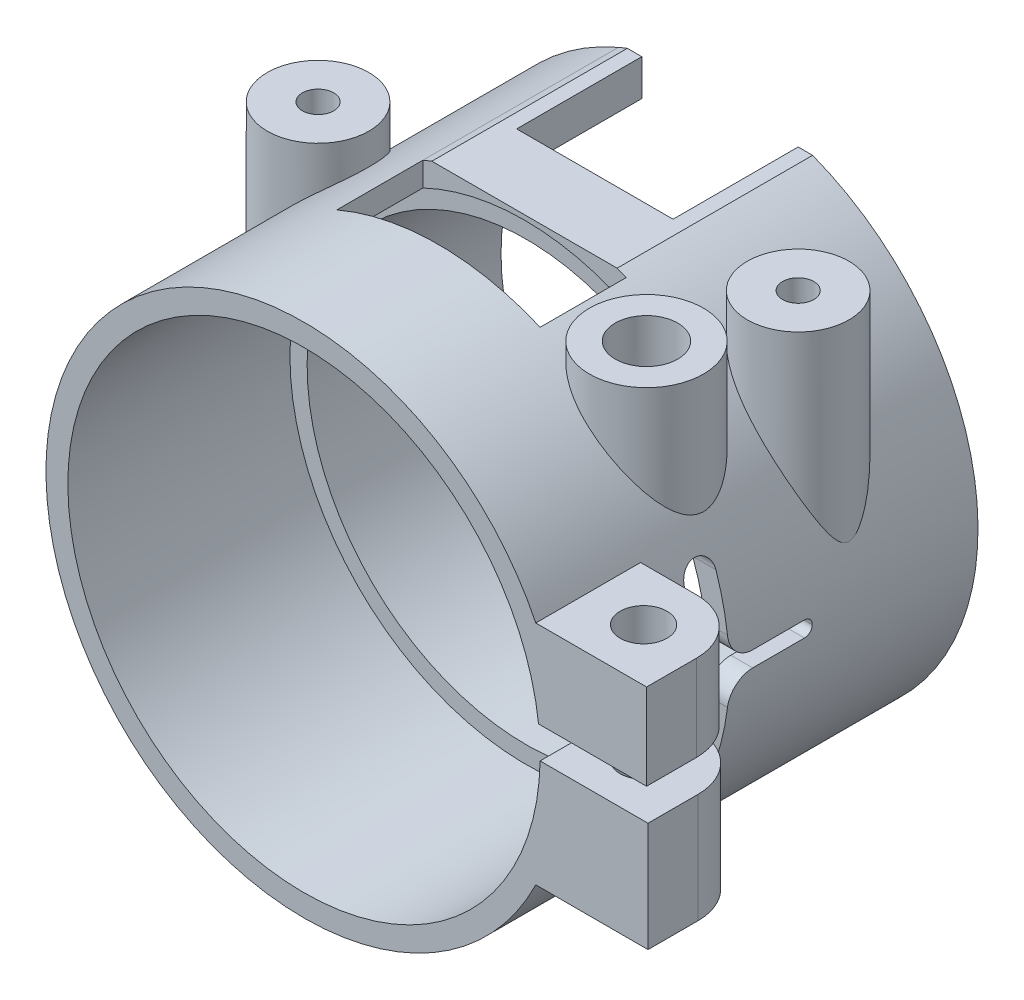
from build123d import *

# Parameters (mm, degrees)
CROQUIS1_R                   = 16.5
CROQUIS1_R_2                 = 14
SALIENTE_EXTRUIR1_DEPTH      = 12.4
CROQUIS2_R                   = 16.5
CROQUIS2_R_2                 = 15.1
SALIENTE_EXTRUIR2_DEPTH      = 14.2
CROQUIS6_W                   = 10
CROQUIS6_H                   = 3.423303169
CORTAR_EXTRUIR4_DEPTH        = 8
CROQUIS7_W                   = 12.5
CROQUIS7_H                   = 1.1
CORTAR_EXTRUIR5_DEPTH        = 18
CORTAR_EXTRUIR6_REACH        = 46.693
CORTAR_EXTRUIR6_END_RADIUS   = 15.1
CROQUIS8_W                   = 13
CROQUIS8_H                   = 5.5
SALIENTE_EXTRUIR3_REACH      = 46.693
SALIENTE_EXTRUIR3_END_RADIUS = 16.5
CROQUIS9_R                   = 3.65
CROQUIS9_R_2                 = 2
CROQUIS9_R_3                 = 3.25
CROQUIS9_R_4                 = 1
CORTAR_EXTRUIR7_REACH        = 46.693
CROQUIS10_R                  = 2
CORTAR_EXTRUIR8_REACH        = 50.084
SALIENTE_EXTRUIR4_START      = -6.7
SALIENTE_EXTRUIR4_DEPTH      = 6.7
REDONDEO1_R                  = 3.5
CROQUIS13_R                  = 1.5
CORTAR_EXTRUIR9_DEPTH        = 42.899230406


with BuildPart() as part:
    # Croquis1 → Saliente-Extruir1 (new body)
    with BuildSketch(Plane.XY):
        with Locations(Location((0, 0, 0), (0, 0, 180))):
            Circle(CROQUIS1_R)
        with Locations(Location((0, 0, 0), (0, 0, 180))):
            Circle(CROQUIS1_R_2, mode=Mode.SUBTRACT)
    extrude(amount=SALIENTE_EXTRUIR1_DEPTH)

    # Croquis2 → Saliente-Extruir2 (add)
    with BuildSketch(Plane.XY.offset(12.4)):
        with Locations(Location((0, 0, 0), (0, 0, 180))):
            Circle(CROQUIS2_R)
        Circle(CROQUIS2_R_2, mode=Mode.SUBTRACT)
    extrude(amount=SALIENTE_EXTRUIR2_DEPTH)

    # Croquis6 → Cortar-Extruir4 (cut)
    with BuildSketch(Plane(origin=(0, 0, 0), x_dir=(-1, 0, 0), z_dir=(0, 0, -1))):
        with Locations((0, 14.788348415)):
            Rectangle(CROQUIS6_W, CROQUIS6_H)
    extrude(amount=-CORTAR_EXTRUIR4_DEPTH, mode=Mode.SUBTRACT)

    # Croquis7 → Cortar-Extruir5 (cut)
    with BuildSketch(Plane(origin=(0, 0, 0), x_dir=(-1, 0, 0), z_dir=(0, 0, -1))):
        with Locations((0, 15.95)):
            Rectangle(CROQUIS7_W, CROQUIS7_H)
    extrude(amount=-CORTAR_EXTRUIR5_DEPTH, mode=Mode.SUBTRACT)

    # Cortar-Extruir6: up to this cylinder (the profile starts outside it)
    cortar_extruir6_end = Plane(origin=(0, 0, 15.25), z_dir=(0, 0, -1)) * Cylinder(CORTAR_EXTRUIR6_END_RADIUS, 124.586, mode=Mode.PRIVATE)
    # Croquis8 → Cortar-Extruir6 (cut, up to the surface)
    with BuildSketch(Plane(origin=(0, 15.4, 0), x_dir=(1, 0, 0), z_dir=(0, 1, 0)), mode=Mode.PRIVATE) as cortar_extruir6_sk1:
        with Locations((0, -15.25)):
            Rectangle(CROQUIS8_W, CROQUIS8_H)
    cortar_extruir6_tool1 = extrude(cortar_extruir6_sk1.sketch, amount=-CORTAR_EXTRUIR6_REACH, mode=Mode.PRIVATE) - cortar_extruir6_end
    add(cortar_extruir6_tool1.solids().sort_by_distance((0, 15.4, 15.25))[0], mode=Mode.SUBTRACT)

    # Saliente-Extruir3: up to this cylinder (the profile starts outside it)
    saliente_extruir3_end = Plane(origin=(0, 0, 8.422581), z_dir=(0, 0, -1)) * Cylinder(SALIENTE_EXTRUIR3_END_RADIUS, 134.647314, mode=Mode.PRIVATE)
    # Croquis9 → Saliente-Extruir3 (add, up to the surface)
    with BuildSketch(Plane(origin=(0, 15.4, 0), x_dir=(1, 0, 0), z_dir=(0, 1, 0)), mode=Mode.PRIVATE) as saliente_extruir3_sk1:
        with Locations(Location((10.9, -15.6, 0), (0, 0, 270))):
            Circle(CROQUIS9_R)
        with Locations(Location((10.9, -15.6, 0), (0, 0, 270))):
            Circle(CROQUIS9_R_2, mode=Mode.SUBTRACT)
    saliente_extruir3_tool1 = extrude(saliente_extruir3_sk1.sketch, amount=-SALIENTE_EXTRUIR3_REACH, mode=Mode.PRIVATE) - saliente_extruir3_end
    add(saliente_extruir3_tool1.solids().sort_by_distance((10.9, 15.4, 12.053238))[0])
    # Croquis9 → Saliente-Extruir3 (add, up to the surface)
    with BuildSketch(Plane(origin=(0, 15.4, 0), x_dir=(1, 0, 0), z_dir=(0, 1, 0)), mode=Mode.PRIVATE) as saliente_extruir3_sk2:
        with Locations(Location((12.95, -7.95, 0), (0, 0, 270))):
            Circle(CROQUIS9_R_3)
        with Locations(Location((12.95, -7.95, 0), (0, 0, 270))):
            Circle(CROQUIS9_R_4, mode=Mode.SUBTRACT)
    saliente_extruir3_tool2 = extrude(saliente_extruir3_sk2.sketch, amount=-SALIENTE_EXTRUIR3_REACH, mode=Mode.PRIVATE) - saliente_extruir3_end
    add(saliente_extruir3_tool2.solids().sort_by_distance((12.95, 15.4, 4.791924))[0])
    # Croquis9 → Saliente-Extruir3 (add, up to the surface)
    with BuildSketch(Plane(origin=(0, 15.4, 0), x_dir=(1, 0, 0), z_dir=(0, 1, 0)), mode=Mode.PRIVATE) as saliente_extruir3_sk3:
        with Locations(Location((-12.85, -12.85, 0), (0, 0, 270))):
            Circle(CROQUIS9_R_3)
        with Locations(Location((-12.85, -12.85, 0), (0, 0, 270))):
            Circle(CROQUIS9_R_4, mode=Mode.SUBTRACT)
    saliente_extruir3_tool3 = extrude(saliente_extruir3_sk3.sketch, amount=-SALIENTE_EXTRUIR3_REACH, mode=Mode.PRIVATE) - saliente_extruir3_end
    add(saliente_extruir3_tool3.solids().sort_by_distance((-12.85, 15.4, 9.691924))[0])

    # Croquis10 → Cortar-Extruir7 (cut, up to next)
    with BuildSketch(Plane(origin=(0, 15.4, 0), x_dir=(1, 0, 0), z_dir=(0, 1, 0)), mode=Mode.PRIVATE) as cortar_extruir7_sk1:
        with Locations(Location((10.9, -15.6, 0), (0, 0, 270))):
            Circle(CROQUIS10_R)
    cortar_extruir7_tool1 = extrude(cortar_extruir7_sk1.sketch, amount=-CORTAR_EXTRUIR7_REACH, mode=Mode.PRIVATE) & part.part
    add(cortar_extruir7_tool1.solids().sort_by_distance((10.9, 15.4, 15.6))[0], mode=Mode.SUBTRACT)

    # Croquis11 → Cortar-Extruir8 (cut, up to next)
    with BuildSketch(Plane(origin=(20, 0, 0), x_dir=(0, 0, -1), z_dir=(1, 0, 0)), mode=Mode.PRIVATE) as cortar_extruir8_sk1:
        with BuildLine():
            Line((-26.6, 1.75), (-19.4, 1.75))
            ThreePointArc((-19.4, 1.75), (-18.339339828, 2.189339828), (-17.9, 3.25))
            Line((-17.9, 3.25), (-17.9, 5.26))
            ThreePointArc((-17.9, 5.26), (-17.610035713, 5.960035713), (-16.91, 6.25))
            Line((-16.91, 6.25), (-16.89, 6.25))
            ThreePointArc((-16.89, 6.25), (-16.189964287, 5.960035713), (-15.9, 5.26))
            Line((-15.9, 5.26), (-15.9, 2))
            ThreePointArc((-15.9, 2), (-15.460660172, 0.939339828), (-14.4, 0.5))
            Line((-14.4, 0.5), (-11.09, 0.5))
            ThreePointArc((-11.09, 0.5), (-10.743517677, 0.356482323), (-10.6, 0.01))
            Line((-10.6, 0.01), (-10.6, -0.01))
            ThreePointArc((-10.6, -0.01), (-10.743517677, -0.356482323), (-11.09, -0.5))
            Line((-11.09, -0.5), (-14.4, -0.5))
            ThreePointArc((-14.4, -0.5), (-15.460660172, -0.939339828), (-15.9, -2))
            Line((-15.9, -2), (-15.9, -5.26))
            ThreePointArc((-15.9, -5.26), (-16.189964287, -5.960035713), (-16.89, -6.25))
            Line((-16.89, -6.25), (-16.91, -6.25))
            ThreePointArc((-16.91, -6.25), (-17.610035713, -5.960035713), (-17.9, -5.26))
            Line((-17.9, -5.26), (-17.9, -3.25))
            ThreePointArc((-17.9, -3.25), (-18.339339828, -2.189339828), (-19.4, -1.75))
            Line((-19.4, -1.75), (-26.6, -1.75))
            Line((-26.6, -1.75), (-26.6, 1.75))
        make_face()
    cortar_extruir8_tool1 = extrude(cortar_extruir8_sk1.sketch, amount=-CORTAR_EXTRUIR8_REACH, mode=Mode.PRIVATE) & part.part
    add(cortar_extruir8_tool1.solids().sort_by_distance((20, 0, 19.23572))[0], mode=Mode.SUBTRACT)

    # Croquis12 → Saliente-Extruir4 (add)
    with BuildSketch(Plane.XY.offset(26.6).offset(SALIENTE_EXTRUIR4_START)):
        with BuildLine():
            Line((14.821858858, 7.25), (21.907078456, 7.25))
            Line((21.907078456, 7.25), (21.907078456, 1.75))
            Line((21.907078456, 1.75), (16.40693451, 1.75))
            ThreePointArc((16.40693451, 1.75), (15.854711722, 4.56925773), (14.821858858, 7.25))
        make_face()
        with BuildLine():
            Line((16.498105952, -0.25), (21.998249898, -0.25))
            Line((21.998249898, -0.25), (21.998249898, -7.25))
            Line((21.998249898, -7.25), (14.821858858, -7.25))
            ThreePointArc((14.821858858, -7.25), (15.854711722, -4.56925773), (16.40693451, -1.75))
            Line((16.40693451, -1.75), (14.998249898, -1.75))
            ThreePointArc((14.998249898, -1.75), (15.066768597, -1.001241253), (15.097930322, -0.25))
            Line((15.097930322, -0.25), (16.498105952, -0.25))
        make_face()
    extrude(amount=SALIENTE_EXTRUIR4_DEPTH)

    # Redondeo1
    redondeo1_edges = [part.edges().sort_by_distance(p)[0] for p in [
        (21.907078456, 4.5, 19.9),
        (21.998249898, -3.75, 19.9),
    ]]
    fillet(redondeo1_edges, radius=REDONDEO1_R)

    # Croquis13 → Cortar-Extruir9 (cut, through all)
    with BuildSketch(Plane(origin=(0, 7.25, 0), x_dir=(1, 0, 0), z_dir=(0, 1, 0))):
        with Locations(Location((18.364468657, -23.25, 0), (0, 0, 270))):
            Circle(CROQUIS13_R)
    extrude(amount=-CORTAR_EXTRUIR9_DEPTH, mode=Mode.SUBTRACT)


solid = part.part
